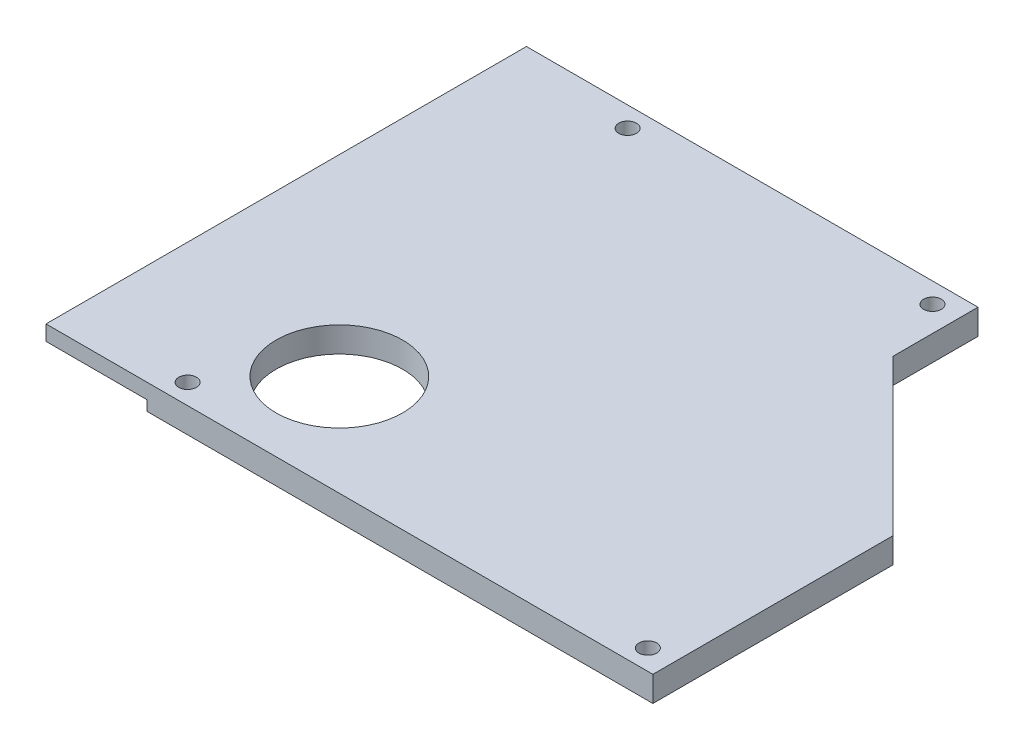
from build123d import *

# Parameters (mm, degrees)
SKETCH1_W               = 200
SKETCH1_H               = 95
SKETCH1_R               = 1.75
BOSS_EXTRUDE1_DEPTH     = 5
SKETCH2_R               = 15
SKETCH2_R_2             = 12.5
CUT_EXTRUDE1_DEPTH      = 5
SKETCH4_W               = 16
SKETCH4_H               = 37
BOSS_EXTRUDE2_DEPTH     = 4.2
SKETCH6_W               = 20
SKETCH6_H               = 95
BOSS_EXTRUDE3_DEPTH     = 3
BOSS_EXTRUDE4_START     = 4
BOSS_EXTRUDE4_DEPTH     = 4
SKETCH9_R               = 13
BOSS_EXTRUDE5_DEPTH     = 2
CUT_EXTRUDE2_DEPTH      = 5
SKETCH11_R              = 1.75
CUT_EXTRUDE3_DEPTH      = 10
CUT_EXTRUDE4_DEPTH      = 10
CUT_EXTRUDE4_DEPTH_BACK = 10
SKETCH14_R              = 1.75


with BuildPart() as part:
    # Sketch1 → Boss-Extrude1 (new body)
    with BuildSketch(Plane(origin=(0, 0, 0), x_dir=(1, 0, 0), z_dir=(0, 1, 0))):
        Rectangle(SKETCH1_W, SKETCH1_H)
        with Locations(Location((-96, 43.5, 0), (0, 0, 270))):
            Circle(SKETCH1_R, mode=Mode.SUBTRACT)
        with Locations(Location((-96, -43.5, 0), (0, 0, 270))):
            Circle(SKETCH1_R, mode=Mode.SUBTRACT)
        with Locations(Location((97, 43.5, 0), (0, 0, 270))):
            Circle(SKETCH1_R, mode=Mode.SUBTRACT)
        with Locations(Location((97, -43.5, 0), (0, 0, 270))):
            Circle(SKETCH1_R, mode=Mode.SUBTRACT)
    extrude(amount=BOSS_EXTRUDE1_DEPTH)

    # Sketch2 → Cut-Extrude1 (cut)
    with BuildSketch(Plane(origin=(0, 5, 0), x_dir=(1, 0, 0), z_dir=(0, 1, 0))):
        with Locations((33.5, 0)):
            Circle(SKETCH2_R)
        with BuildLine():
            ThreePointArc((48.5, 0), (39.240251485, -13.858192988), (22.893398282, -10.606601718))
            Line((22.893398282, -10.606601718), (47.393398282, -35.106601718))
            ThreePointArc((47.393398282, -35.106601718), (52.259748515, -10.641807012), (73, -24.5))
            ThreePointArc((73, -24.5), (71.858192988, -30.240251485), (68.606601718, -35.106601718))
            Line((68.606601718, -35.106601718), (93.106601718, -10.606601718))
            ThreePointArc((93.106601718, -10.606601718), (67.5, 0), (93.106601718, 10.606601718))
            Line((93.106601718, 10.606601718), (68.606601718, 35.106601718))
            ThreePointArc((68.606601718, 35.106601718), (71.858192988, 30.240251485), (73, 24.5))
            ThreePointArc((73, 24.5), (52.259748515, 10.641807012), (47.393398282, 35.106601718))
            Line((47.393398282, 35.106601718), (22.893398282, 10.606601718))
            ThreePointArc((22.893398282, 10.606601718), (39.240251485, 13.858192988), (48.5, 0))
        make_face()
        with Locations((58, -24.5)):
            Circle(SKETCH2_R)
        with Locations((82.5, 0)):
            Circle(SKETCH2_R)
        with Locations((58, 24.5)):
            Circle(SKETCH2_R)
        with Locations(Location((-82, -27.5, 0), (0, 0, 270))):
            Circle(SKETCH2_R_2)
    extrude(amount=-CUT_EXTRUDE1_DEPTH, mode=Mode.SUBTRACT)

    # Sketch4 → Boss-Extrude2 (add)
    with BuildSketch(Plane.XZ):
        with Locations((-82.5, -19.5)):
            Rectangle(SKETCH4_W, SKETCH4_H)
    extrude(amount=BOSS_EXTRUDE2_DEPTH)

    # Sketch6 → Boss-Extrude3 (add)
    with BuildSketch(Plane(origin=(0, 5, 0), x_dir=(1, 0, 0), z_dir=(0, 1, 0))):
        with Locations((-110, 0)):
            Rectangle(SKETCH6_W, SKETCH6_H)
        with Locations((110, 0)):
            Rectangle(SKETCH6_W, SKETCH6_H)
    extrude(amount=-BOSS_EXTRUDE3_DEPTH)

    # Sketch8 → Boss-Extrude4 (add)
    with BuildSketch(Plane(origin=(0, 5, 0), x_dir=(1, 0, 0), z_dir=(0, 1, 0)).offset(BOSS_EXTRUDE4_START)):
        with BuildLine():
            Line((70.727922061, -37.227922061), (95.227922061, -12.727922061))
            ThreePointArc((95.227922061, -12.727922061), (100.5, 0), (95.227922061, 12.727922061))
            Line((95.227922061, 12.727922061), (70.727922061, 37.227922061))
            ThreePointArc((70.727922061, 37.227922061), (58, 42.5), (45.272077939, 37.227922061))
            Line((45.272077939, 37.227922061), (20.772077939, 12.727922061))
            ThreePointArc((20.772077939, 12.727922061), (15.5, 0), (20.772077939, -12.727922061))
            Line((20.772077939, -12.727922061), (45.272077939, -37.227922061))
            ThreePointArc((45.272077939, -37.227922061), (58, -42.5), (70.727922061, -37.227922061))
        make_face()
        with BuildLine():
            Line((22.893398282, -10.606601718), (47.393398282, -35.106601718))
            ThreePointArc((47.393398282, -35.106601718), (58, -39.5), (68.606601718, -35.106601718))
            Line((68.606601718, -35.106601718), (93.106601718, -10.606601718))
            ThreePointArc((93.106601718, -10.606601718), (97.5, 0), (93.106601718, 10.606601718))
            Line((93.106601718, 10.606601718), (68.606601718, 35.106601718))
            ThreePointArc((68.606601718, 35.106601718), (58, 39.5), (47.393398282, 35.106601718))
            Line((47.393398282, 35.106601718), (22.893398282, 10.606601718))
            ThreePointArc((22.893398282, 10.606601718), (18.5, 0), (22.893398282, -10.606601718))
        make_face(mode=Mode.SUBTRACT)
    extrude(amount=-BOSS_EXTRUDE4_DEPTH)

    # Sketch9 → Boss-Extrude5 (add)
    with BuildSketch(Plane(origin=(0, 9, 0), x_dir=(1, 0, 0), z_dir=(0, 1, 0))):
        with BuildLine():
            Line((22.893398282, -10.606601718), (47.393398282, -35.106601718))
            ThreePointArc((47.393398282, -35.106601718), (58, -39.5), (68.606601718, -35.106601718))
            Line((68.606601718, -35.106601718), (93.106601718, -10.606601718))
            ThreePointArc((93.106601718, -10.606601718), (97.5, 0), (93.106601718, 10.606601718))
            Line((93.106601718, 10.606601718), (68.606601718, 35.106601718))
            ThreePointArc((68.606601718, 35.106601718), (58, 39.5), (47.393398282, 35.106601718))
            Line((47.393398282, 35.106601718), (22.893398282, 10.606601718))
            ThreePointArc((22.893398282, 10.606601718), (18.5, 0), (22.893398282, -10.606601718))
        make_face()
        with Locations(Location((58, 24.5, 0), (0, 0, 270))):
            Circle(SKETCH9_R, mode=Mode.SUBTRACT)
        with Locations(Location((82.5, 0, 0), (0, 0, 270))):
            Circle(SKETCH9_R, mode=Mode.SUBTRACT)
        with Locations(Location((58, -24.5, 0), (0, 0, 270))):
            Circle(SKETCH9_R, mode=Mode.SUBTRACT)
        with Locations(Location((33.5, 0, 0), (0, 0, 270))):
            Circle(SKETCH9_R, mode=Mode.SUBTRACT)
    extrude(amount=-BOSS_EXTRUDE5_DEPTH)

    # Sketch10 → Cut-Extrude2 (cut)
    with BuildSketch(Plane(origin=(0, 5, 0), x_dir=(1, 0, 0), z_dir=(0, 1, 0))):
        Polygon((0, 38.5), (-7.778174593, 30.721825407), (0, 22.943650814), (7.778174593, 30.721825407), align=None)
    extrude(amount=-CUT_EXTRUDE2_DEPTH, mode=Mode.SUBTRACT)

    # Sketch11 → Cut-Extrude3 (cut)
    with BuildSketch(Plane(origin=(0, 5, 0), x_dir=(1, 0, 0), z_dir=(0, 1, 0))):
        with Locations(Location((-35.721825407, 43.5, 0), (0, 0, 270))):
            Circle(SKETCH11_R)
        with Locations(Location((-25.721825407, 43.5, 0), (0, 0, 270))):
            Circle(SKETCH11_R)
        with Locations(Location((5, -43.5, 0), (0, 0, 270))):
            Circle(SKETCH11_R)
        with Locations(Location((-5, -43.5, 0), (0, 0, 270))):
            Circle(SKETCH11_R)
    extrude(amount=-CUT_EXTRUDE3_DEPTH, mode=Mode.SUBTRACT)

    # Sketch14 → Cut-Extrude4 (cut, two sides: drawn at the far end of the back side and taken through both)
    # profile 1 of 3: a face of its own
    with BuildSketch(Plane(origin=(0, 5, 0), x_dir=(1, 0, 0), z_dir=(0, 1, 0)).offset(-CUT_EXTRUDE4_DEPTH_BACK)):
        Polygon((-30.721825407, 47.5), (-30.721825407, 30.721825407), (0, 0), (0, -47.5), (120, -47.5), (120, 47.5), align=None)
        with Locations((5, -43.5)):
            Circle(SKETCH14_R, mode=Mode.SUBTRACT)
        with Locations((97, -43.5)):
            Circle(SKETCH14_R, mode=Mode.SUBTRACT)
        with BuildLine():
            ThreePointArc((45.272077939, 37.227922061), (58, 42.5), (70.727922061, 37.227922061))
            Line((70.727922061, 37.227922061), (95.227922061, 12.727922061))
            ThreePointArc((95.227922061, 12.727922061), (100.5, 0), (95.227922061, -12.727922061))
            Line((95.227922061, -12.727922061), (70.727922061, -37.227922061))
            ThreePointArc((70.727922061, -37.227922061), (58, -42.5), (45.272077939, -37.227922061))
            Line((45.272077939, -37.227922061), (20.772077939, -12.727922061))
            ThreePointArc((20.772077939, -12.727922061), (15.5, 0), (20.772077939, 12.727922061))
            Line((20.772077939, 12.727922061), (45.272077939, 37.227922061))
        make_face(mode=Mode.SUBTRACT)
        with Locations((-25.721825407, 43.5)):
            Circle(SKETCH14_R, mode=Mode.SUBTRACT)
        Polygon((-7.778174593, 30.721825407), (0, 38.5), (7.778174593, 30.721825407), (0, 22.943650814), align=None, mode=Mode.SUBTRACT)
        with Locations((97, 43.5)):
            Circle(SKETCH14_R, mode=Mode.SUBTRACT)
    # profile 2 of 3: a face of its own
    with BuildSketch(Plane(origin=(0, 5, 0), x_dir=(1, 0, 0), z_dir=(0, 1, 0)).offset(-CUT_EXTRUDE4_DEPTH_BACK)):
        with BuildLine():
            Line((70.727922061, 37.227922061), (95.227922061, 12.727922061))
            ThreePointArc((95.227922061, 12.727922061), (100.5, 0), (95.227922061, -12.727922061))
            Line((95.227922061, -12.727922061), (70.727922061, -37.227922061))
            ThreePointArc((70.727922061, -37.227922061), (58, -42.5), (45.272077939, -37.227922061))
            Line((45.272077939, -37.227922061), (20.772077939, -12.727922061))
            ThreePointArc((20.772077939, -12.727922061), (15.5, 0), (20.772077939, 12.727922061))
            Line((20.772077939, 12.727922061), (45.272077939, 37.227922061))
            ThreePointArc((45.272077939, 37.227922061), (58, 42.5), (70.727922061, 37.227922061))
        make_face()
    # profile 3 of 3: a face of its own
    with BuildSketch(Plane(origin=(0, 5, 0), x_dir=(1, 0, 0), z_dir=(0, 1, 0)).offset(-CUT_EXTRUDE4_DEPTH_BACK)):
        Polygon((0, 38.5), (7.778174593, 30.721825407), (0, 22.943650814), (-7.778174593, 30.721825407), align=None)
    extrude(amount=CUT_EXTRUDE4_DEPTH + CUT_EXTRUDE4_DEPTH_BACK, mode=Mode.SUBTRACT)


solid = part.part
